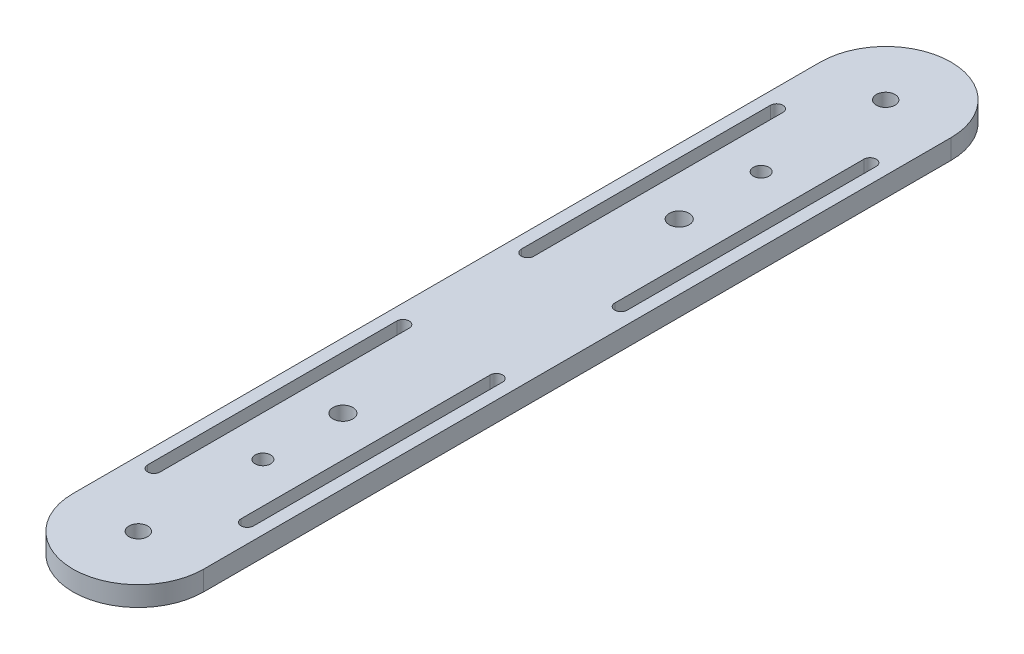
from build123d import *

# Parameters (mm, degrees)
SKETCH1_R               = 1.5
BOSS_EXTRUDE1_DEPTH     = 3.175
CUT_EXTRUDE1_DEPTH      = 131.960225355
CUT_EXTRUDE1_DEPTH_BACK = 131.960225355
CUT_EXTRUDE2_DEPTH      = 131.960225355
CUT_EXTRUDE2_DEPTH_BACK = 131.960225355
CUT_EXTRUDE3_DEPTH      = 131.960225355
CUT_EXTRUDE3_DEPTH_BACK = 131.960225355
SKETCH4_R               = 1.6
CUT_EXTRUDE4_DEPTH      = 40


with BuildPart() as part:
    # Sketch1 → Boss-Extrude1 (new body)
    with BuildSketch(Plane(origin=(0, 0, 0), x_dir=(1, 0, 0), z_dir=(0, 1, 0))):
        with BuildLine():
            Line((-10.5, 0), (-10.5, -120))
            ThreePointArc((-10.5, -120), (0, -130.5), (10.5, -120))
            Line((10.5, -120), (10.5, 0))
            ThreePointArc((10.5, 0), (0, 10.5), (-10.5, 0))
        make_face()
        with Locations(Location((0, 0, 0), (0, 0, 270))):
            Circle(SKETCH1_R, mode=Mode.SUBTRACT)
        with Locations(Location((0, -120, 0), (0, 0, 270))):
            Circle(SKETCH1_R, mode=Mode.SUBTRACT)
    extrude(amount=BOSS_EXTRUDE1_DEPTH)

    # Sketch2 → Cut-Extrude1 (cut, two sides: drawn at the far end of the back side and taken through both)
    with BuildSketch(Plane.XZ.offset(-CUT_EXTRUDE1_DEPTH_BACK)):
        with BuildLine():
            ThreePointArc((0, 18.75), (1.25, 20), (0, 21.25))
            ThreePointArc((0, 21.25), (-1.25, 20), (0, 18.75))
        make_face()
    extrude(amount=CUT_EXTRUDE1_DEPTH + CUT_EXTRUDE1_DEPTH_BACK, mode=Mode.SUBTRACT)

    # Sketch3 → Cut-Extrude2 (cut, two sides: drawn at the far end of the back side and taken through both)
    with BuildSketch(Plane(origin=(0, 3.175, 0), x_dir=(1, 0, 0), z_dir=(0, 1, 0)).offset(-CUT_EXTRUDE2_DEPTH_BACK)):
        with BuildLine():
            ThreePointArc((0, -98.75), (-1.25, -100), (0, -101.25))
            ThreePointArc((0, -101.25), (1.25, -100), (0, -98.75))
        make_face()
    extrude(amount=CUT_EXTRUDE2_DEPTH + CUT_EXTRUDE2_DEPTH_BACK, mode=Mode.SUBTRACT)

    # Sketch4 → Cut-Extrude3 (cut, two sides: drawn at the far end of the back side and taken through both)
    with BuildSketch(Plane(origin=(0, 3.175, 0), x_dir=(1, 0, 0), z_dir=(0, 1, 0)).offset(-CUT_EXTRUDE3_DEPTH_BACK)):
        with Locations(Location((0, -33.15, 0), (0, 0, 270))):
            Circle(SKETCH4_R)
        with Locations(Location((0, -87.15, 0), (0, 0, 270))):
            Circle(SKETCH4_R)
    extrude(amount=CUT_EXTRUDE3_DEPTH + CUT_EXTRUDE3_DEPTH_BACK, mode=Mode.SUBTRACT)

    # Sketch5 → Cut-Extrude4 (cut)
    with BuildSketch(Plane.XZ):
        with BuildLine():
            Line((-8.5, 10), (-8.5, 50))
            ThreePointArc((-8.5, 50), (-7.5, 51), (-6.5, 50))
            Line((-6.5, 50), (-6.5, 10))
            ThreePointArc((-6.5, 10), (-7.5, 9), (-8.5, 10))
        make_face()
        with BuildLine():
            Line((6.5, 50), (6.5, 10))
            ThreePointArc((6.5, 10), (7.5, 9), (8.5, 10))
            Line((8.5, 10), (8.5, 50))
            ThreePointArc((8.5, 50), (7.5, 51), (6.5, 50))
        make_face()
        with BuildLine():
            Line((8.5, 110), (8.5, 70))
            ThreePointArc((8.5, 70), (7.5, 69), (6.5, 70))
            Line((6.5, 70), (6.5, 110))
            ThreePointArc((6.5, 110), (7.5, 111), (8.5, 110))
        make_face()
        with BuildLine():
            Line((-6.5, 70), (-6.5, 110))
            ThreePointArc((-6.5, 110), (-7.5, 111), (-8.5, 110))
            Line((-8.5, 110), (-8.5, 70))
            ThreePointArc((-8.5, 70), (-7.5, 69), (-6.5, 70))
        make_face()
    extrude(amount=-CUT_EXTRUDE4_DEPTH, mode=Mode.SUBTRACT)


solid = part.part
